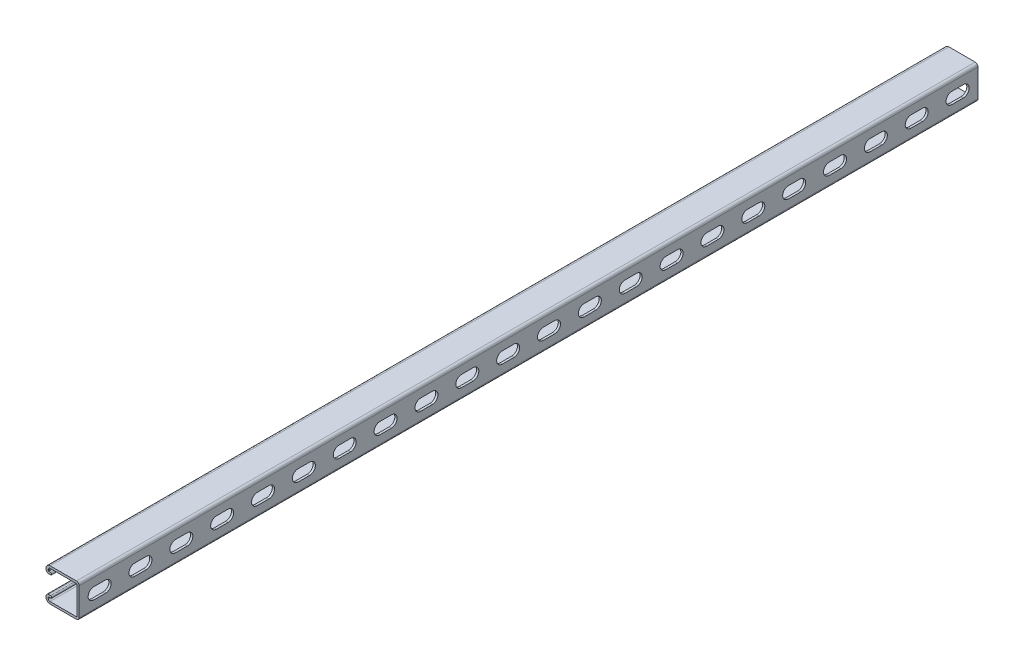
from build123d import *

# Parameters (mm, degrees)
BOSS_EXTRUDE1_DEPTH = 1117.6
CUT_EXTRUDE1_DEPTH  = 2.794
LPATTERN1_COUNT     = 22
LPATTERN1_PITCH     = 50.8


with BuildPart() as part:
    # Sketch1 → Boss-Extrude1 (new body)
    with BuildSketch(Plane.XY):
        with BuildLine():
            Line((-36.22675, 20.6375), (-3.46075, 20.6375))
            ThreePointArc((-3.46075, 20.6375), (-1.013630207, 19.623869793), (0, 17.17675))
            Line((0, 17.17675), (0, -17.17675))
            ThreePointArc((0, -17.17675), (-1.013630207, -19.623869793), (-3.46075, -20.6375))
            Line((-3.46075, -20.6375), (-36.22675, -20.6375))
            ThreePointArc((-36.22675, -20.6375), (-39.796401808, -19.158901808), (-41.275, -15.58925))
            Line((-41.275, -15.58925), (-41.275, -14.57325))
            ThreePointArc((-41.275, -14.57325), (-40.261369793, -12.126130207), (-37.81425, -11.1125))
            Line((-37.81425, -11.1125), (-35.5346, -11.1125))
            ThreePointArc((-35.5346, -11.1125), (-34.1376, -12.5095), (-35.5346, -13.9065))
            Line((-35.5346, -13.9065), (-37.81425, -13.9065))
            ThreePointArc((-37.81425, -13.9065), (-38.285713446, -14.101786554), (-38.481, -14.57325))
            Line((-38.481, -14.57325), (-38.481, -15.58925))
            ThreePointArc((-38.481, -15.58925), (-37.820745461, -17.183245461), (-36.22675, -17.8435))
            Line((-36.22675, -17.8435), (-3.46075, -17.8435))
            ThreePointArc((-3.46075, -17.8435), (-2.989286554, -17.648213446), (-2.794, -17.17675))
            Line((-2.794, -17.17675), (-2.794, 17.17675))
            ThreePointArc((-2.794, 17.17675), (-2.989286554, 17.648213446), (-3.46075, 17.8435))
            Line((-3.46075, 17.8435), (-36.22675, 17.8435))
            ThreePointArc((-36.22675, 17.8435), (-37.820745461, 17.183245461), (-38.481, 15.58925))
            Line((-38.481, 15.58925), (-38.481, 14.57325))
            ThreePointArc((-38.481, 14.57325), (-38.285713446, 14.101786554), (-37.81425, 13.9065))
            Line((-37.81425, 13.9065), (-35.5346, 13.9065))
            ThreePointArc((-35.5346, 13.9065), (-34.1376, 12.5095), (-35.5346, 11.1125))
            Line((-35.5346, 11.1125), (-37.81425, 11.1125))
            ThreePointArc((-37.81425, 11.1125), (-40.261369793, 12.126130207), (-41.275, 14.57325))
            Line((-41.275, 14.57325), (-41.275, 15.58925))
            ThreePointArc((-41.275, 15.58925), (-39.796401808, 19.158901808), (-36.22675, 20.6375))
        make_face()
    extrude(amount=-BOSS_EXTRUDE1_DEPTH)

    # Sketch2 → Cut-Extrude1 (cut)
    with BuildSketch(Plane(origin=(0, 0, 0), x_dir=(0, 0, -1), z_dir=(1, 0, 0))):
        with BuildLine():
            Line((18.25625, 7.14375), (32.54375, 7.14375))
            ThreePointArc((32.54375, 7.14375), (39.6875, 0), (32.54375, -7.14375))
            Line((32.54375, -7.14375), (18.25625, -7.14375))
            ThreePointArc((18.25625, -7.14375), (11.1125, 0), (18.25625, 7.14375))
        make_face()
    cut_extrude1 = extrude(amount=-CUT_EXTRUDE1_DEPTH, mode=Mode.SUBTRACT)

    # LPattern1: Cut-Extrude1 ×22
    with Locations(*[(0, 0, -i * LPATTERN1_PITCH) for i in range(1, LPATTERN1_COUNT)]):
        add(cut_extrude1, mode=Mode.SUBTRACT)


solid = part.part
